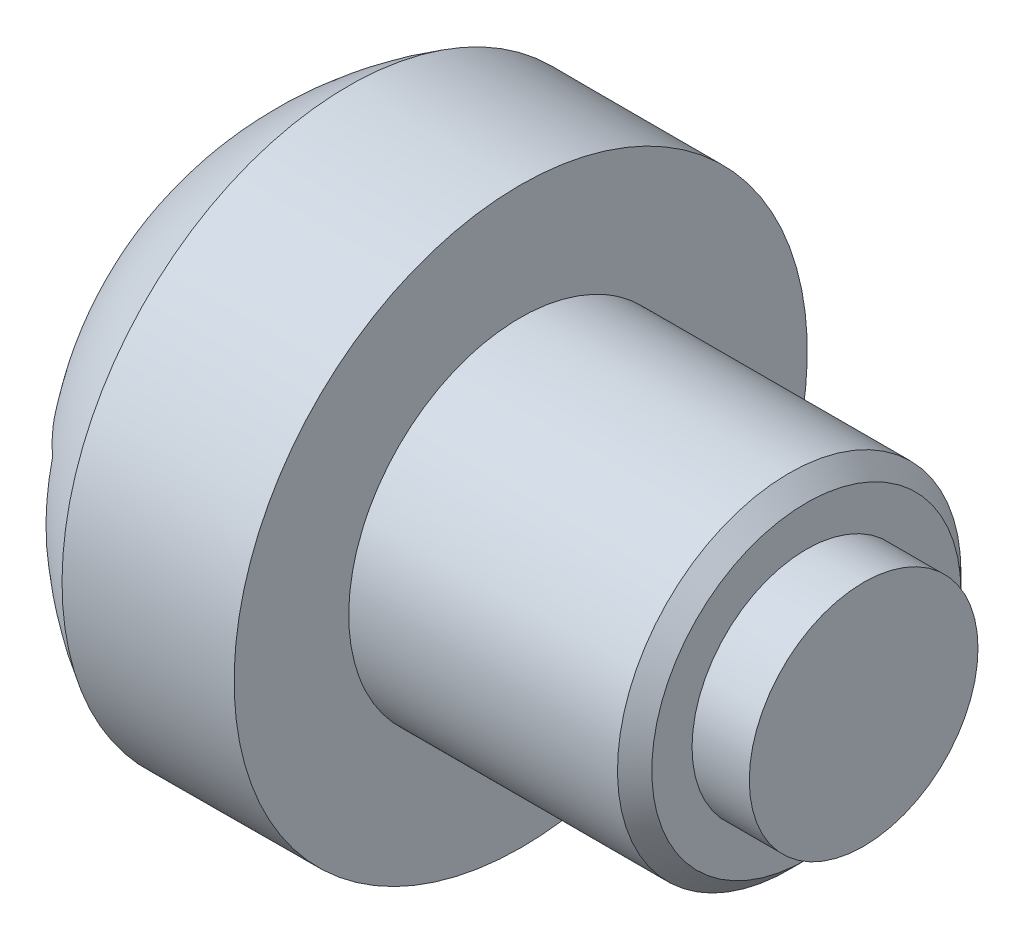
from build123d import *

# Parameters (mm, degrees)
CUT_EXTRUDE2_DEPTH      = 2
CUT_EXTRUDE2_DEPTH_BACK = 1.81
SKETCH16_W              = 10.023590622
SKETCH16_H              = 2
SKETCH25_R              = 3
BOSS_EXTRUDE4_DEPTH     = 5
CHAMFER1_SIZE           = 0.3
SKETCH43_R              = 1.997454852
BOSS_EXTRUDE6_DEPTH     = 1


with BuildPart() as part:
    # Sketch2 → Revolve2 (revolve)
    with BuildSketch(Plane.XY):
        with BuildLine():
            ThreePointArc((-1.5, 6.225604788), (-3.652462654, 4.106847096), (-4.5, 1.207897271))
            Line((-4.5, 1.207897271), (-1.5, 1.213799777))
            Line((-1.5, 1.213799777), (-1.5, 6.225604788))
        make_face()
        Polygon((-1.5, 6.225604788), (-1.5, 1.213799777), (1.5, 1.219702283), (1.5, 6.225604788), align=None)
    revolve(axis=Axis((-4.5, 1.207897271, 0), (0.9999980644737863, 0.0019674980765590857, 0)))

    # Sketch16 → Cut-Extrude2 (cut, two sides: drawn at the far end of the back side and taken through both)
    with BuildSketch(Plane.ZY.offset(4.3).offset(-CUT_EXTRUDE2_DEPTH_BACK)):
        with Locations((0, 1.207897271)):
            Rectangle(SKETCH16_W, SKETCH16_H)
    extrude(amount=CUT_EXTRUDE2_DEPTH + CUT_EXTRUDE2_DEPTH_BACK, mode=Mode.SUBTRACT)

    # Sketch25 → Boss-Extrude4 (add)
    with BuildSketch(Plane(origin=(1.5, 0, 0), x_dir=(0, 0, -1), z_dir=(1, 0, 0))):
        with Locations(Location((0, 1.219702283, 0), (0, 0, 305.537696461))):
            Circle(SKETCH25_R)
    extrude(amount=BOSS_EXTRUDE4_DEPTH)

    # Chamfer1
    chamfer1_edges = [part.edges().sort_by_distance(p)[0] for p in [
        (6.5, 3.660902128, 1.743715377),
    ]]
    chamfer(chamfer1_edges, length=CHAMFER1_SIZE)

    # Sketch43 → Boss-Extrude6 (add)
    with BuildSketch(Plane(origin=(6.5, 0, 0), x_dir=(0, 0, -1), z_dir=(1, 0, 0))):
        with Locations((0, 1.219702283)):
            Circle(SKETCH43_R)
    extrude(amount=BOSS_EXTRUDE6_DEPTH)


solid = part.part
